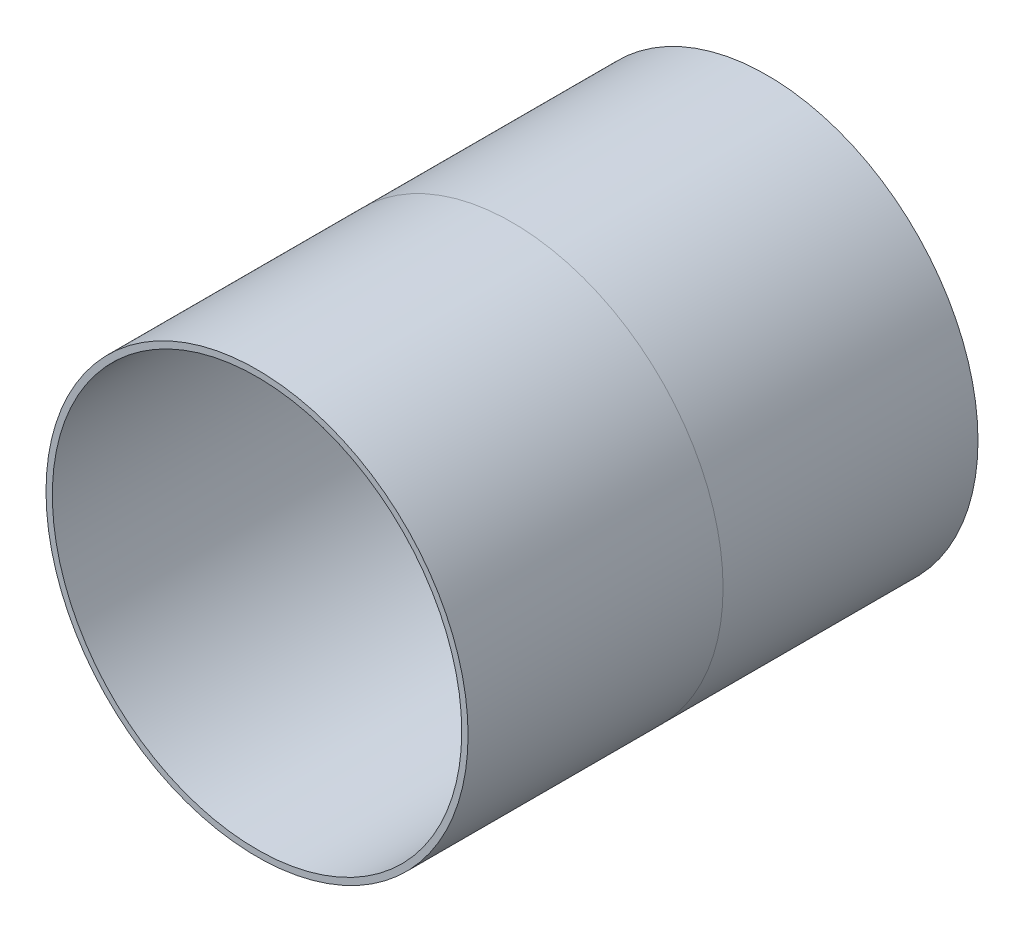
from build123d import *

# Parameters (mm, degrees)
ESQUISSE2_R        = 76.1746
ESQUISSE2_R_2      = 73.914
BOSS_EXTRU_1_DEPTH = 92.075
ESQUISSE3_R        = 76.2
ESQUISSE3_R_2      = 73.914
BOSS_EXTRU_2_DEPTH = 92.075


with BuildPart() as part:
    # Esquisse2 → Boss.-Extru.1 (new body)
    with BuildSketch(Plane.XY):
        Circle(ESQUISSE2_R)
        Circle(ESQUISSE2_R_2, mode=Mode.SUBTRACT)
    extrude(amount=BOSS_EXTRU_1_DEPTH)

    # Esquisse3 → Boss.-Extru.2 (add)
    with BuildSketch(Plane.XY.offset(92.075)):
        Circle(ESQUISSE3_R)
        Circle(ESQUISSE3_R_2, mode=Mode.SUBTRACT)
    extrude(amount=BOSS_EXTRU_2_DEPTH)


solid = part.part
